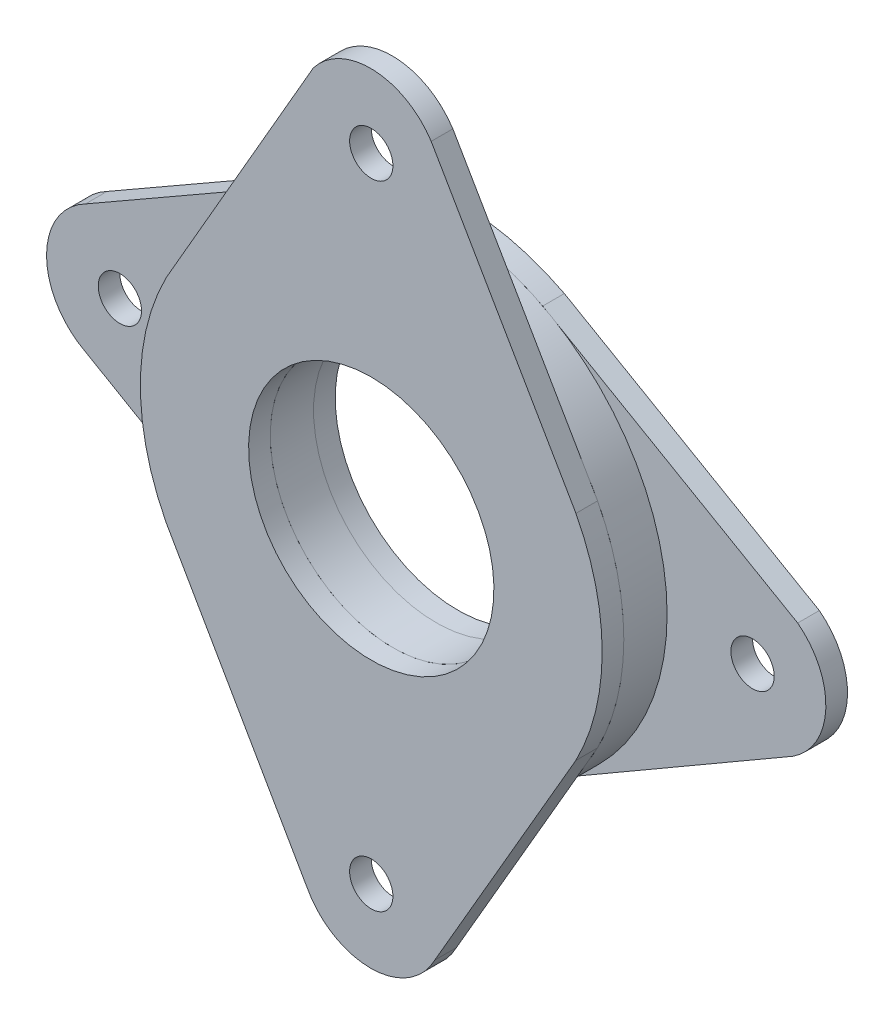
from build123d import *

# Parameters (mm, degrees)
BOSS_EXTRUDE1_DEPTH      = 1.5
SKETCH2_R                = 1.5
SKETCH2_R_2              = 8.5
CUT_EXTRUDE1_DEPTH       = 32.420495375
BODY_MOVE_COPY1_ANGLE    = 90
BOSS_EXTRUDE2_DEPTH      = 1.5
BOSS_EXTRUDE2_DEPTH_BACK = 1.5
SKETCH3_R                = 16
SKETCH3_R_2              = 8.5


with BuildPart() as part:
    # Sketch1 → Boss-Extrude1 (new body)
    with BuildSketch(Plane.XY):
        with BuildLine():
            Line((7.379381976, 14.196644732), (25.046611975, 4.009443432))
            ThreePointArc((25.046611975, 4.009443432), (26.995880172, -0.156936678), (24.716922459, -4.152524428))
            Line((24.716922459, -4.152524428), (7.407985651, -14.181739971))
            ThreePointArc((7.407985651, -14.181739971), (-0.010581597, -15.999996501), (-7.426737349, -14.171929027))
            Line((-7.426737349, -14.171929027), (-24.302900872, -4.393201109))
            ThreePointArc((-24.302900872, -4.393201109), (-26.99995272, 0.040951738), (-24.309846191, 4.479321596))
            Line((-24.309846191, 4.479321596), (-7.325019927, 14.224770053))
            ThreePointArc((-7.325019927, 14.224770053), (0.030603374, 15.999970732), (7.379381976, 14.196644732))
        make_face()
    extrude(amount=BOSS_EXTRUDE1_DEPTH)

    # Sketch2 → Cut-Extrude1 (cut, through all)
    with BuildSketch(Plane.XY.offset(1.5)):
        with Locations((-21.92, 0)):
            Circle(SKETCH2_R)
        with Locations((21.92, 0)):
            Circle(SKETCH2_R)
        Circle(SKETCH2_R_2)
    extrude(amount=-CUT_EXTRUDE1_DEPTH, mode=Mode.SUBTRACT)


with BuildPart() as body_2:
    # Mirror2: mirrored copy
    add(part.part.mirror(Plane.XY.offset(3)))


with BuildPart() as body_2_1:
    # Body-Move/Copy1: moved
    add(body_2.part.rotate(Axis((0, 0, 0), (0, 0, 1)), BODY_MOVE_COPY1_ANGLE))


with BuildPart() as body_3:
    # Sketch3 → Boss-Extrude2 (new, two sides: drawn at the far end of the back side and taken through both)
    with BuildSketch(Plane.XY.offset(3).offset(-BOSS_EXTRUDE2_DEPTH_BACK)):
        Circle(SKETCH3_R)
        Circle(SKETCH3_R_2, mode=Mode.SUBTRACT)
    extrude(amount=BOSS_EXTRUDE2_DEPTH + BOSS_EXTRUDE2_DEPTH_BACK)


solid = Compound([part.part, body_2_1.part, body_3.part])
